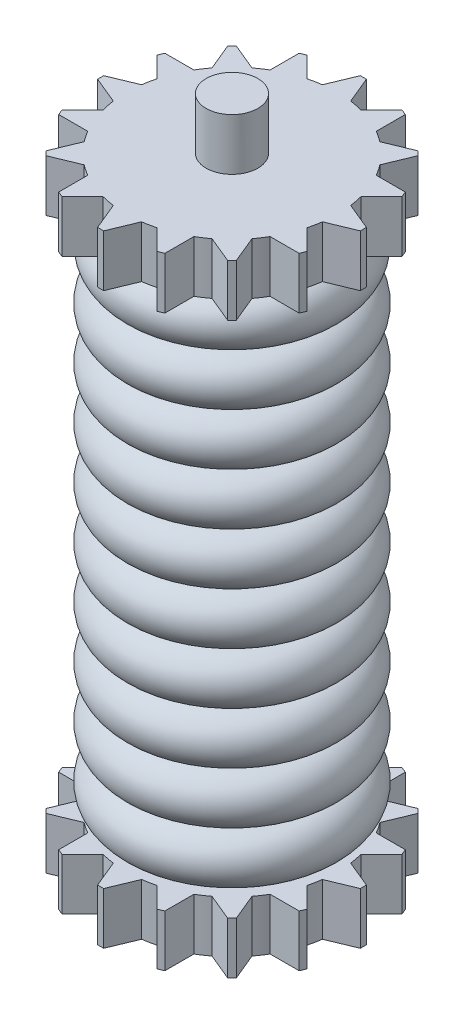
from build123d import *

# Parameters (mm, degrees)
SKETCH6_W           = 100
SKETCH6_H           = 16.625
BOSS_EXTRUDE3_DEPTH = 10
SKETCH4_R           = 5
BOSS_EXTRUDE4_DEPTH = 10


with BuildPart() as part:
    # Sketch6 → Revolve1 (revolve)
    with BuildSketch(Plane(origin=(0, 0, 0), x_dir=(0, 1, 0), z_dir=(0, 0, 1)), mode=Mode.PRIVATE) as revolve1_sk:
        with Locations((50, -8.3125)):
            Rectangle(SKETCH6_W, SKETCH6_H)
        with BuildLine():
            Line((10, -16.625), (0, -16.625))
            ThreePointArc((0, -16.625), (5, -21.625), (10, -16.625))
        make_face()
        with BuildLine():
            Line((20, -16.625), (10, -16.625))
            ThreePointArc((10, -16.625), (15, -21.625), (20, -16.625))
        make_face()
        with BuildLine():
            Line((30, -16.625), (20, -16.625))
            ThreePointArc((20, -16.625), (25, -21.625), (30, -16.625))
        make_face()
        with BuildLine():
            Line((40, -16.625), (30, -16.625))
            ThreePointArc((30, -16.625), (35, -21.625), (40, -16.625))
        make_face()
        with BuildLine():
            Line((50, -16.625), (40, -16.625))
            ThreePointArc((40, -16.625), (45, -21.625), (50, -16.625))
        make_face()
        with BuildLine():
            ThreePointArc((50, -16.625), (55, -21.625), (60, -16.625))
            Line((60, -16.625), (50, -16.625))
        make_face()
        with BuildLine():
            ThreePointArc((60, -16.625), (65, -21.625), (70, -16.625))
            Line((70, -16.625), (60, -16.625))
        make_face()
        with BuildLine():
            ThreePointArc((70, -16.625), (75, -21.625), (80, -16.625))
            Line((80, -16.625), (70, -16.625))
        make_face()
        with BuildLine():
            ThreePointArc((80, -16.625), (85, -21.625), (90, -16.625))
            Line((90, -16.625), (80, -16.625))
        make_face()
        with BuildLine():
            ThreePointArc((90, -16.625), (95, -21.625), (100, -16.625))
            Line((100, -16.625), (90, -16.625))
        make_face()
    revolve(revolve1_sk.sketch.rotate(Axis((0, 0, 0), (0, 1, 0)), 90), axis=Axis((0, 0, 0), (0, 1, 0)))

    # Sketch3 → Boss-Extrude3 (add)
    with BuildSketch(Plane.XZ):
        with BuildLine():
            Line((-2.733, 20.190872591), (-0.588491123, 25.368175007))
            ThreePointArc((-0.588491123, 25.368175007), (0, 25.375), (0.588491123, 25.368175007))
            Line((0.588491123, 25.368175007), (2.733, 20.190872591))
            ThreePointArc((2.733, 20.190872591), (3.974965311, 19.983500088), (5.201749663, 19.699807751))
            Line((5.201749663, 19.699807751), (9.164285381, 23.662343469))
            ThreePointArc((9.164285381, 23.662343469), (9.710592096, 23.443443137), (10.251675188, 23.211931864))
            Line((10.251675188, 23.211931864), (10.251675188, 17.60806011))
            ThreePointArc((10.251675188, 17.60806011), (11.319743498, 16.941193351), (12.344580094, 16.20962576))
            Line((12.344580094, 16.20962576), (17.52188251, 18.354134638))
            ThreePointArc((17.52188251, 18.354134638), (17.942834573, 17.942834573), (18.354134638, 17.52188251))
            Line((18.354134638, 17.52188251), (16.20962576, 12.344580094))
            ThreePointArc((16.20962576, 12.344580094), (16.941193351, 11.319743498), (17.60806011, 10.251675188))
            Line((17.60806011, 10.251675188), (23.211931864, 10.251675188))
            ThreePointArc((23.211931864, 10.251675188), (23.443443137, 9.710592096), (23.662343469, 9.164285381))
            Line((23.662343469, 9.164285381), (19.699807751, 5.201749663))
            ThreePointArc((19.699807751, 5.201749663), (19.983500088, 3.974965311), (20.190872591, 2.733))
            Line((20.190872591, 2.733), (25.368175007, 0.588491123))
            ThreePointArc((25.368175007, 0.588491123), (25.375, 0), (25.368175007, -0.588491123))
            Line((25.368175007, -0.588491123), (20.190872591, -2.733))
            ThreePointArc((20.190872591, -2.733), (19.983500088, -3.974965311), (19.699807751, -5.201749663))
            Line((19.699807751, -5.201749663), (23.662343469, -9.164285381))
            ThreePointArc((23.662343469, -9.164285381), (23.443443137, -9.710592096), (23.211931864, -10.251675188))
            Line((23.211931864, -10.251675188), (17.60806011, -10.251675188))
            ThreePointArc((17.60806011, -10.251675188), (16.941193351, -11.319743498), (16.20962576, -12.344580094))
            Line((16.20962576, -12.344580094), (18.354134638, -17.52188251))
            ThreePointArc((18.354134638, -17.52188251), (17.942834573, -17.942834573), (17.52188251, -18.354134638))
            Line((17.52188251, -18.354134638), (12.344580094, -16.20962576))
            ThreePointArc((12.344580094, -16.20962576), (11.319743498, -16.941193351), (10.251675188, -17.60806011))
            Line((10.251675188, -17.60806011), (10.251675188, -23.211931864))
            ThreePointArc((10.251675188, -23.211931864), (9.710592096, -23.443443137), (9.164285381, -23.662343469))
            Line((9.164285381, -23.662343469), (5.201749663, -19.699807751))
            ThreePointArc((5.201749663, -19.699807751), (3.974965311, -19.983500088), (2.733, -20.190872591))
            Line((2.733, -20.190872591), (0.588491123, -25.368175007))
            ThreePointArc((0.588491123, -25.368175007), (0, -25.375), (-0.588491123, -25.368175007))
            Line((-0.588491123, -25.368175007), (-2.733, -20.190872591))
            ThreePointArc((-2.733, -20.190872591), (-3.974965311, -19.983500088), (-5.201749663, -19.699807751))
            Line((-5.201749663, -19.699807751), (-9.164285381, -23.662343469))
            ThreePointArc((-9.164285381, -23.662343469), (-9.710592096, -23.443443137), (-10.251675188, -23.211931864))
            Line((-10.251675188, -23.211931864), (-10.251675188, -17.60806011))
            ThreePointArc((-10.251675188, -17.60806011), (-11.319743498, -16.941193351), (-12.344580094, -16.20962576))
            Line((-12.344580094, -16.20962576), (-17.52188251, -18.354134638))
            ThreePointArc((-17.52188251, -18.354134638), (-17.942834573, -17.942834573), (-18.354134638, -17.52188251))
            Line((-18.354134638, -17.52188251), (-16.20962576, -12.344580094))
            ThreePointArc((-16.20962576, -12.344580094), (-16.941193351, -11.319743498), (-17.60806011, -10.251675188))
            Line((-17.60806011, -10.251675188), (-23.211931864, -10.251675188))
            ThreePointArc((-23.211931864, -10.251675188), (-23.443443137, -9.710592096), (-23.662343469, -9.164285381))
            Line((-23.662343469, -9.164285381), (-19.699807751, -5.201749663))
            ThreePointArc((-19.699807751, -5.201749663), (-19.983500088, -3.974965311), (-20.190872591, -2.733))
            Line((-20.190872591, -2.733), (-25.368175007, -0.588491123))
            ThreePointArc((-25.368175007, -0.588491123), (-25.375, 0), (-25.368175007, 0.588491123))
            Line((-25.368175007, 0.588491123), (-20.190872591, 2.733))
            ThreePointArc((-20.190872591, 2.733), (-19.983500088, 3.974965311), (-19.699807751, 5.201749663))
            Line((-19.699807751, 5.201749663), (-23.662343469, 9.164285381))
            ThreePointArc((-23.662343469, 9.164285381), (-23.443443137, 9.710592096), (-23.211931864, 10.251675188))
            Line((-23.211931864, 10.251675188), (-17.60806011, 10.251675188))
            ThreePointArc((-17.60806011, 10.251675188), (-16.941193351, 11.319743498), (-16.20962576, 12.344580094))
            Line((-16.20962576, 12.344580094), (-18.354134638, 17.52188251))
            ThreePointArc((-18.354134638, 17.52188251), (-17.942834573, 17.942834573), (-17.52188251, 18.354134638))
            Line((-17.52188251, 18.354134638), (-12.344580094, 16.20962576))
            ThreePointArc((-12.344580094, 16.20962576), (-11.319743498, 16.941193351), (-10.251675188, 17.60806011))
            Line((-10.251675188, 17.60806011), (-10.251675188, 23.211931864))
            ThreePointArc((-10.251675188, 23.211931864), (-9.710592096, 23.443443137), (-9.164285381, 23.662343469))
            Line((-9.164285381, 23.662343469), (-5.201749663, 19.699807751))
            ThreePointArc((-5.201749663, 19.699807751), (-3.974965311, 19.983500088), (-2.733, 20.190872591))
        make_face()
    boss_extrude3 = extrude(amount=BOSS_EXTRUDE3_DEPTH)

    # Mirror1: Boss-Extrude3 across plane
    add(boss_extrude3.mirror(Plane.ZX.offset(50)))

    # Sketch4 → Boss-Extrude4 (add)
    with BuildSketch(Plane.XZ.offset(10)):
        with Locations(Location((0, 0, 0), (0, 0, 270))):
            Circle(SKETCH4_R)
    boss_extrude4 = extrude(amount=BOSS_EXTRUDE4_DEPTH)

    # Mirror2: Boss-Extrude4 across plane
    add(boss_extrude4.mirror(Plane.ZX.offset(50)))


solid = part.part
